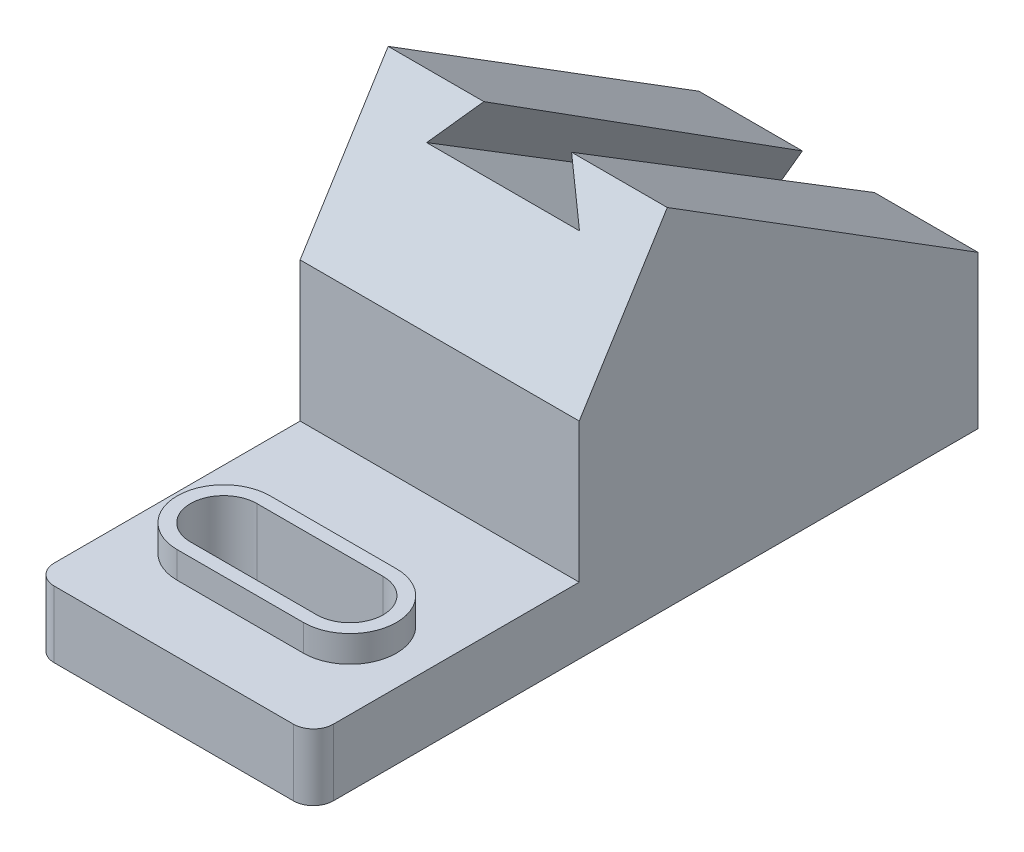
from build123d import *

# Parameters (mm, degrees)
BOSS_EXTRUDE1_DEPTH = 21
CUT_EXTRUDE1_DEPTH  = 60
CUT_EXTRUDE1_DRAFT  = -1
CUT_EXTRUDE2_REACH  = 112.553
BOSS_EXTRUDE2_START = 4
BOSS_EXTRUDE2_DEPTH = 4


with BuildPart() as part:
    # Sketch1 → Boss-Extrude1 (new, symmetric)
    with BuildSketch(Plane(origin=(0, 0, 0), x_dir=(0, 0, -1), z_dir=(1, 0, 0))):
        Polygon((0, 0), (-100, 0), (-100, 10), (-60, 10), (-60, 31), (-46.752018394, 52.201202404), (0, 22.987298969), align=None)
    extrude(amount=BOSS_EXTRUDE1_DEPTH, both=True)


with BuildPart() as cut_extrude1_tool:
    # Sketch2 → Cut-Extrude1 (with draft: the straight prism first)
    with BuildSketch(Plane(origin=(0, 35.669068614, 57.082442121), x_dir=(1, 0, 0), z_dir=(0, 0.5299192642331993, 0.8480480961564296))):
        Polygon((5.821903288, 20.603497628), (-5.821903288, 20.603497628), (-11.5, 12.494335127), (11.5, 12.494335127), align=None)
    extrude(amount=-CUT_EXTRUDE1_DEPTH)
    # Cut-Extrude1: the draft: its side faces are tilted about the plane it starts from
    cut_extrude1_sides = [cut_extrude1_tool.faces().sort_by_distance(p)[0] for p in [
        (0, 30.367287804, 25.020010359),
        (8.660951644, 33.805767714, 22.871409646),
        (0, 37.244247624, 20.722808933),
        (-8.660951644, 33.805767714, 22.871409646),
    ]]
    draft(cut_extrude1_sides, Plane(origin=(0, 35.669068614, 57.082442121), x_dir=(1, 0, 0), z_dir=(0, 0.5299192642331993, 0.8480480961564296)), CUT_EXTRUDE1_DRAFT)


with BuildPart() as part_1:
    add(part.part)

    # Cut-Extrude1: cut by cut_extrude1_tool
    add(cut_extrude1_tool.part, mode=Mode.SUBTRACT)

    # Sketch3 → Cut-Extrude2 (cut, up to next)
    with BuildSketch(Plane(origin=(0, 10, 0), x_dir=(1, 0, 0), z_dir=(0, 1, 0)), mode=Mode.PRIVATE) as cut_extrude2_sk1:
        with BuildLine():
            Line((9.5, -78), (-9.5, -78))
            ThreePointArc((-9.5, -78), (-14.5, -83), (-9.5, -88))
            Line((-9.5, -88), (9.5, -88))
            ThreePointArc((9.5, -88), (14.5, -83), (9.5, -78))
        make_face()
    cut_extrude2_tool1 = extrude(cut_extrude2_sk1.sketch, amount=-CUT_EXTRUDE2_REACH, mode=Mode.PRIVATE) & part_1.part
    # Sketch3 → Cut-Extrude2 (cut, up to next)
    with BuildSketch(Plane(origin=(0, 10, 0), x_dir=(1, 0, 0), z_dir=(0, 1, 0)), mode=Mode.PRIVATE) as cut_extrude2_sk2:
        with BuildLine():
            ThreePointArc((21, -97), (20.121320344, -99.121320344), (18, -100))
            Line((18, -100), (21, -100))
            Line((21, -100), (21, -97))
        make_face()
    cut_extrude2_tool2 = extrude(cut_extrude2_sk2.sketch, amount=-CUT_EXTRUDE2_REACH, mode=Mode.PRIVATE) & part_1.part
    # Sketch3 → Cut-Extrude2 (cut, up to next)
    with BuildSketch(Plane(origin=(0, 10, 0), x_dir=(1, 0, 0), z_dir=(0, 1, 0)), mode=Mode.PRIVATE) as cut_extrude2_sk3:
        with BuildLine():
            ThreePointArc((-18, -100), (-20.121320344, -99.121320344), (-21, -97))
            Line((-21, -97), (-21, -100))
            Line((-21, -100), (-18, -100))
        make_face()
    cut_extrude2_tool3 = extrude(cut_extrude2_sk3.sketch, amount=-CUT_EXTRUDE2_REACH, mode=Mode.PRIVATE) & part_1.part
    add(cut_extrude2_tool1.solids().sort_by_distance((0, 10, 83))[0], mode=Mode.SUBTRACT)
    add(cut_extrude2_tool2.solids().sort_by_distance((20.329896, 10, 99.329896))[0], mode=Mode.SUBTRACT)
    add(cut_extrude2_tool3.solids().sort_by_distance((-20.329896, 10, 99.329896))[0], mode=Mode.SUBTRACT)

    # Sketch3<3> → Boss-Extrude2 (add)
    with BuildSketch(Plane(origin=(0, 10, 0), x_dir=(1, 0, 0), z_dir=(0, 1, 0)).offset(BOSS_EXTRUDE2_START)):
        with BuildLine():
            Line((9.5, -76), (-9.5, -76))
            ThreePointArc((-9.5, -76), (-16.5, -83), (-9.5, -90))
            Line((-9.5, -90), (9.5, -90))
            ThreePointArc((9.5, -90), (16.5, -83), (9.5, -76))
        make_face()
        with BuildLine():
            ThreePointArc((-9.5, -88), (-14.5, -83), (-9.5, -78))
            Line((-9.5, -78), (9.5, -78))
            ThreePointArc((9.5, -78), (14.5, -83), (9.5, -88))
            Line((9.5, -88), (-9.5, -88))
        make_face(mode=Mode.SUBTRACT)
    extrude(amount=-BOSS_EXTRUDE2_DEPTH)


solid = part_1.part
